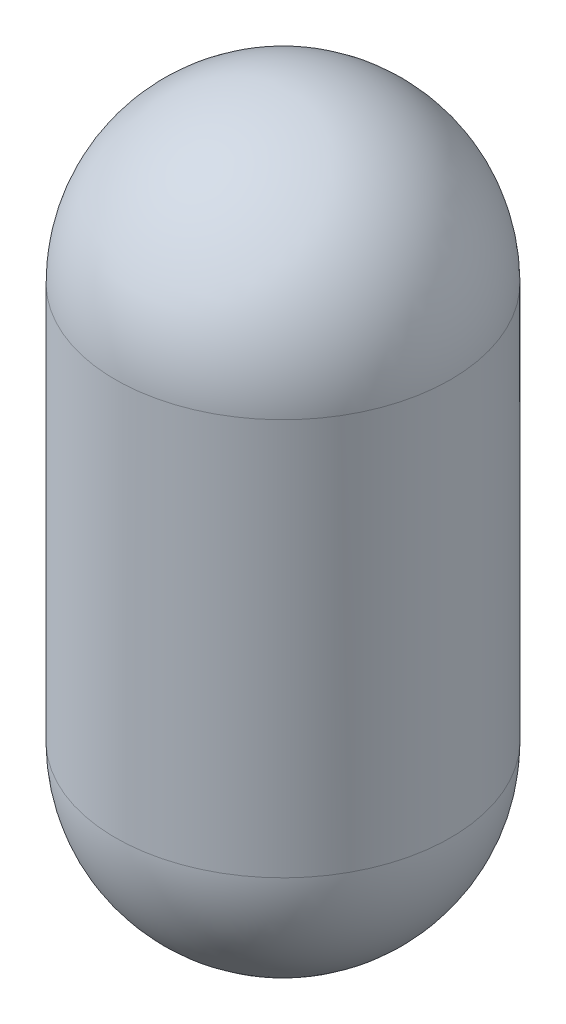
from build123d import *


with BuildPart() as part:
    # Sketch1 → Revolve3 (revolve)
    with BuildSketch(Plane.XY):
        with BuildLine():
            Line((-37.1475, 43.97375), (-37.1475, -43.97375))
            ThreePointArc((-37.1475, -43.97375), (-26.267249154, -70.240999154), (0, -81.12125))
            Line((0, -81.12125), (0, -79.53375))
            ThreePointArc((0, -79.53375), (-25.144717139, -69.118467139), (-35.56, -43.97375))
            Line((-35.56, -43.97375), (-35.56, 43.97375))
            ThreePointArc((-35.56, 43.97375), (-25.144717139, 69.118467139), (0, 79.53375))
            Line((0, 79.53375), (0, 81.12125))
            ThreePointArc((0, 81.12125), (-26.267249154, 70.240999154), (-37.1475, 43.97375))
        make_face()
    revolve(axis=Axis((0, 43.97375, 0), (0, -1, 0)))


solid = part.part
